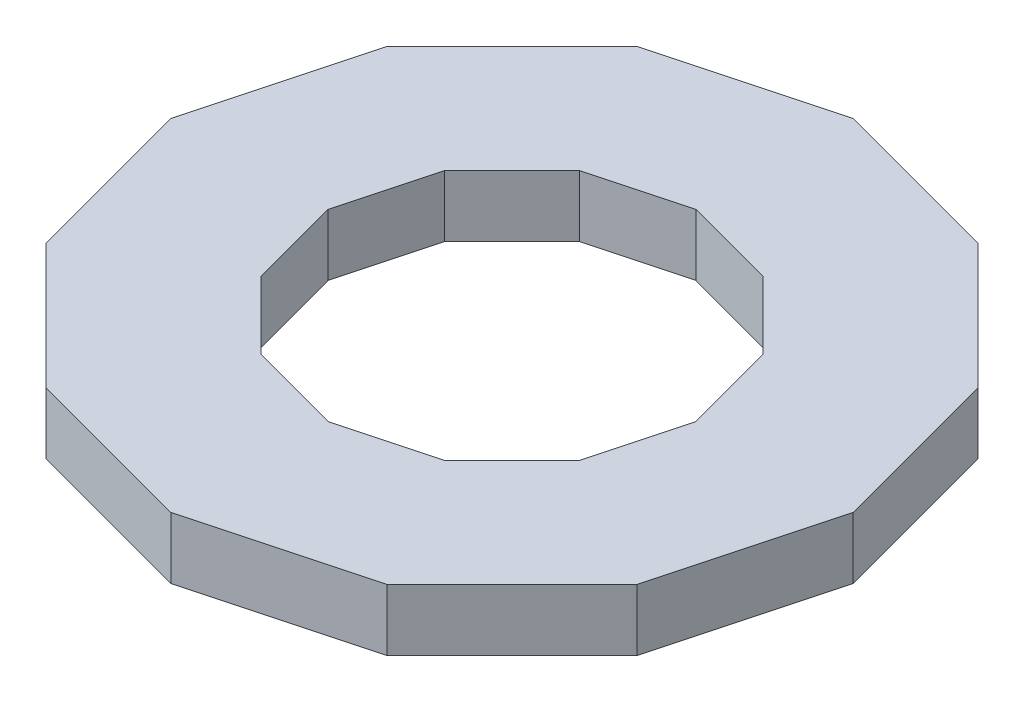
from build123d import *

# Parameters (mm, degrees)
BOSS_EXTRUDE1_DEPTH = 19.05


with BuildPart() as part:
    # Sketch1 → Boss-Extrude1 (new body)
    with BuildSketch(Plane(origin=(0, 0, 0), x_dir=(1, 0, 0), z_dir=(0, 1, 0))):
        Polygon((105.498418747, 0), (91.364310694, 52.749209374), (52.749209374, 91.364310694), (0, 105.498418747), (-52.749209374, 91.364310694), (-91.364310694, 52.749209374), (-105.498418747, 0), (-91.364310694, -52.749209374), (-52.749209374, -91.364310694), (0, -105.498418747), (52.749209374, -91.364310694), (91.364310694, -52.749209374), align=None)
        Polygon((56.85079103, 0), (49.234229257, 28.425395515), (28.425395515, 49.234229257), (0, 56.85079103), (-28.425395515, 49.234229257), (-49.234229257, 28.425395515), (-56.85079103, 0), (-49.234229257, -28.425395515), (-28.425395515, -49.234229257), (0, -56.85079103), (28.425395515, -49.234229257), (49.234229257, -28.425395515), align=None, mode=Mode.SUBTRACT)
    extrude(amount=BOSS_EXTRUDE1_DEPTH)


solid = part.part
